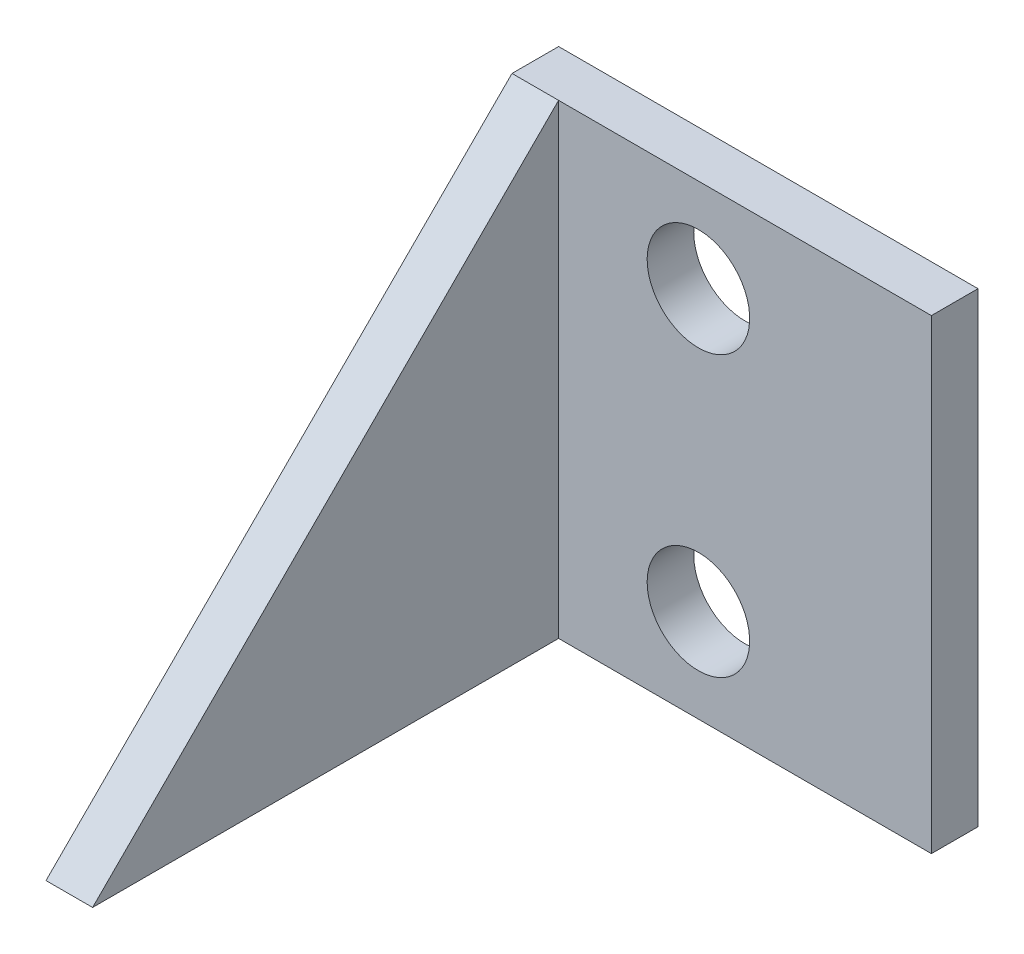
from build123d import *

# Parameters (mm, degrees)
BOSS_EXTRUDE1_DEPTH = 3
SKETCH2_W           = 3
SKETCH2_H           = 30
BOSS_EXTRUDE2_DEPTH = 24
SKETCH5_R           = 3.3
CUT_EXTRUDE1_DEPTH  = 10


with BuildPart() as part:
    # Sketch1 → Boss-Extrude1 (new body)
    with BuildSketch(Plane(origin=(-12, 0, 0), x_dir=(0, 0, -1), z_dir=(1, 0, 0))):
        Polygon((-3, 15), (-33, -15), (0, -15), (0, 15), align=None)
    extrude(amount=-BOSS_EXTRUDE1_DEPTH)

    # Sketch2 → Boss-Extrude2 (add)
    with BuildSketch(Plane(origin=(-12, 0, 0), x_dir=(0, 0, -1), z_dir=(1, 0, 0))):
        with Locations((-1.5, 0)):
            Rectangle(SKETCH2_W, SKETCH2_H)
    extrude(amount=BOSS_EXTRUDE2_DEPTH)

    # Sketch5 → Cut-Extrude1 (cut)
    with BuildSketch(Plane(origin=(0, 0, 0), x_dir=(-1, 0, 0), z_dir=(0, 0, -1))):
        with Locations((3, 9)):
            Circle(SKETCH5_R)
        with Locations((3, -9)):
            Circle(SKETCH5_R)
    extrude(amount=-CUT_EXTRUDE1_DEPTH, mode=Mode.SUBTRACT)


solid = part.part
